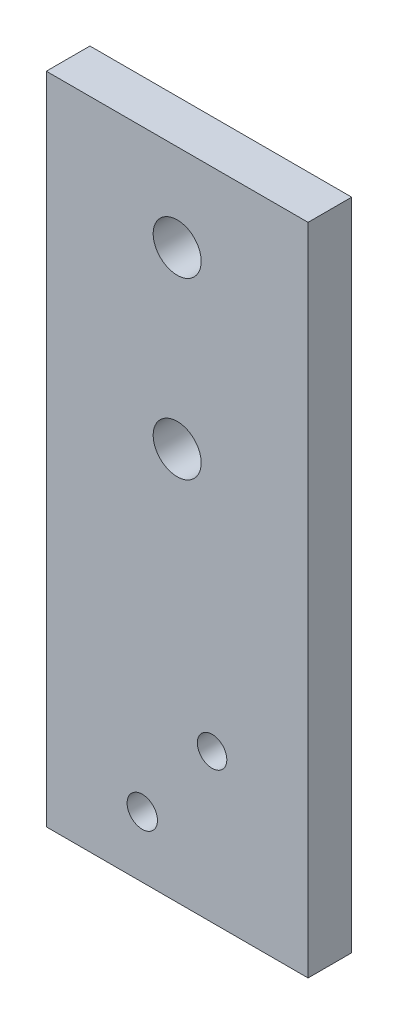
from build123d import *

# Parameters (mm, degrees)
ESQUISSE1_W        = 30
ESQUISSE1_H        = 75
ESQUISSE1_R        = 2.75
ESQUISSE1_R_2      = 1.741302511
ESQUISSE1_R_3      = 1.689311571
BOSS_EXTRU_1_DEPTH = 5


with BuildPart() as part:
    # Esquisse1 → Boss.-Extru.1 (new body)
    with BuildSketch(Plane.XY):
        with Locations((-15, 37.5)):
            Rectangle(ESQUISSE1_W, ESQUISSE1_H)
        with Locations((-15, 65)):
            Circle(ESQUISSE1_R, mode=Mode.SUBTRACT)
        with Locations((-15, 45)):
            Circle(ESQUISSE1_R, mode=Mode.SUBTRACT)
        with Locations((-19, 7)):
            Circle(ESQUISSE1_R_2, mode=Mode.SUBTRACT)
        with Locations((-11, 17)):
            Circle(ESQUISSE1_R_3, mode=Mode.SUBTRACT)
    extrude(amount=BOSS_EXTRU_1_DEPTH)


solid = part.part
